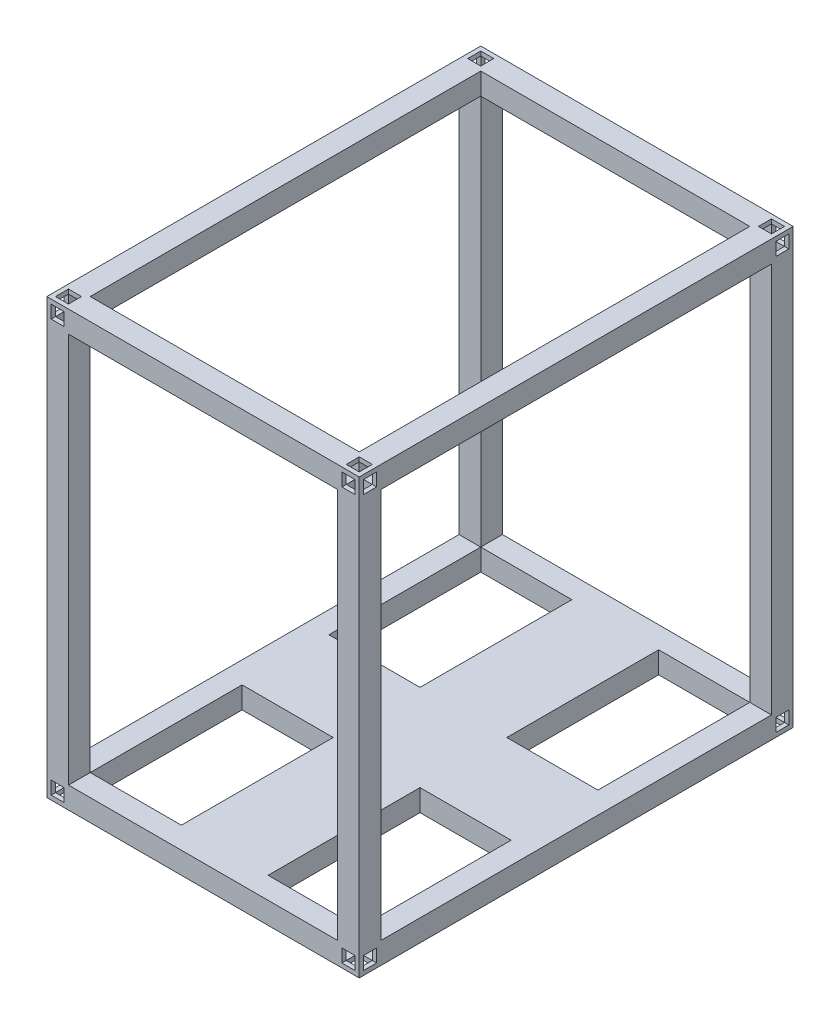
from build123d import *

# Parameters (mm, degrees)
SKETCH1_W           = 180
SKETCH1_H           = 250
BOSS_EXTRUDE1_DEPTH = 250
SKETCH2_W           = 225
SKETCH2_H           = 225
CUT_EXTRUDE2_DEPTH  = 397.736688498
SKETCH3_W           = 155
SKETCH3_H           = 225
CUT_EXTRUDE3_DEPTH  = 397.736688498
SKETCH4_W           = 155
SKETCH4_H           = 225
CUT_EXTRUDE4_DEPTH  = 250
SKETCH7_W           = 7.5
SKETCH7_H           = 7.5
CUT_EXTRUDE6_DEPTH  = 397.736688498
SKETCH8_W           = 7.5
SKETCH8_H           = 7.5
CUT_EXTRUDE7_DEPTH  = 397.736688498
SKETCH9_W           = 7.5
SKETCH9_H           = 7.5
CUT_EXTRUDE8_DEPTH  = 250
SKETCH10_W          = 50
SKETCH10_H          = 12.5
BOSS_EXTRUDE2_DEPTH = 250
SKETCH12_W          = 50
SKETCH12_H          = 12.5
BOSS_EXTRUDE3_DEPTH = 180


with BuildPart() as part:
    # Sketch1 → Boss-Extrude1 (new body)
    with BuildSketch(Plane.XY):
        with Locations((90, -125)):
            Rectangle(SKETCH1_W, SKETCH1_H)
    extrude(amount=BOSS_EXTRUDE1_DEPTH)

    # Sketch2 → Cut-Extrude2 (cut, through all)
    with BuildSketch(Plane(origin=(0, 0, 0), x_dir=(0, 0, -1), z_dir=(1, 0, 0))):
        with Locations((-125, -125)):
            Rectangle(SKETCH2_W, SKETCH2_H)
    extrude(amount=CUT_EXTRUDE2_DEPTH, mode=Mode.SUBTRACT)

    # Sketch3 → Cut-Extrude3 (cut, through all)
    with BuildSketch(Plane.XY.offset(250)):
        with Locations((90, -125)):
            Rectangle(SKETCH3_W, SKETCH3_H)
    extrude(amount=-CUT_EXTRUDE3_DEPTH, mode=Mode.SUBTRACT)

    # Sketch4 → Cut-Extrude4 (cut)
    with BuildSketch(Plane(origin=(0, 0, 0), x_dir=(1, 0, 0), z_dir=(0, 1, 0))):
        with Locations((90, -125)):
            Rectangle(SKETCH4_W, SKETCH4_H)
    extrude(amount=-CUT_EXTRUDE4_DEPTH, mode=Mode.SUBTRACT)

    # Sketch7 → Cut-Extrude6 (cut, through all)
    with BuildSketch(Plane.XY):
        with Locations((6.25, -6.25)):
            Rectangle(SKETCH7_W, SKETCH7_H)
        with Locations((173.75, -6.25)):
            Rectangle(SKETCH7_W, SKETCH7_H)
        with Locations((173.75, -243.75)):
            Rectangle(SKETCH7_W, SKETCH7_H)
        with Locations((6.25, -243.75)):
            Rectangle(SKETCH7_W, SKETCH7_H)
    extrude(amount=CUT_EXTRUDE6_DEPTH, mode=Mode.SUBTRACT)

    # Sketch8 → Cut-Extrude7 (cut, through all)
    with BuildSketch(Plane(origin=(0, 0, 0), x_dir=(1, 0, 0), z_dir=(0, 1, 0))):
        with Locations((6.25, -6.25)):
            Rectangle(SKETCH8_W, SKETCH8_H)
        with Locations((173.75, -6.25)):
            Rectangle(SKETCH8_W, SKETCH8_H)
        with Locations((173.75, -243.75)):
            Rectangle(SKETCH8_W, SKETCH8_H)
        with Locations((6.25, -243.75)):
            Rectangle(SKETCH8_W, SKETCH8_H)
    extrude(amount=-CUT_EXTRUDE7_DEPTH, mode=Mode.SUBTRACT)

    # Sketch9 → Cut-Extrude8 (cut)
    with BuildSketch(Plane(origin=(0, 0, 0), x_dir=(0, 0, -1), z_dir=(1, 0, 0))):
        with Locations((-6.25, -6.25)):
            Rectangle(SKETCH9_W, SKETCH9_H)
        with Locations((-243.75, -6.25)):
            Rectangle(SKETCH9_W, SKETCH9_H)
        with Locations((-243.75, -243.75)):
            Rectangle(SKETCH9_W, SKETCH9_H)
        with Locations((-6.25, -243.75)):
            Rectangle(SKETCH9_W, SKETCH9_H)
    extrude(amount=CUT_EXTRUDE8_DEPTH, mode=Mode.SUBTRACT)

    # Sketch10 → Boss-Extrude2 (add)
    with BuildSketch(Plane.XY):
        with Locations((90, -243.75)):
            Rectangle(SKETCH10_W, SKETCH10_H)
    extrude(amount=BOSS_EXTRUDE2_DEPTH)

    # Sketch12 → Boss-Extrude3 (add)
    with BuildSketch(Plane(origin=(180, 0, 0), x_dir=(0, 0, -1), z_dir=(1, 0, 0))):
        with Locations((-125, -243.75)):
            Rectangle(SKETCH12_W, SKETCH12_H)
    extrude(amount=-BOSS_EXTRUDE3_DEPTH)


solid = part.part
